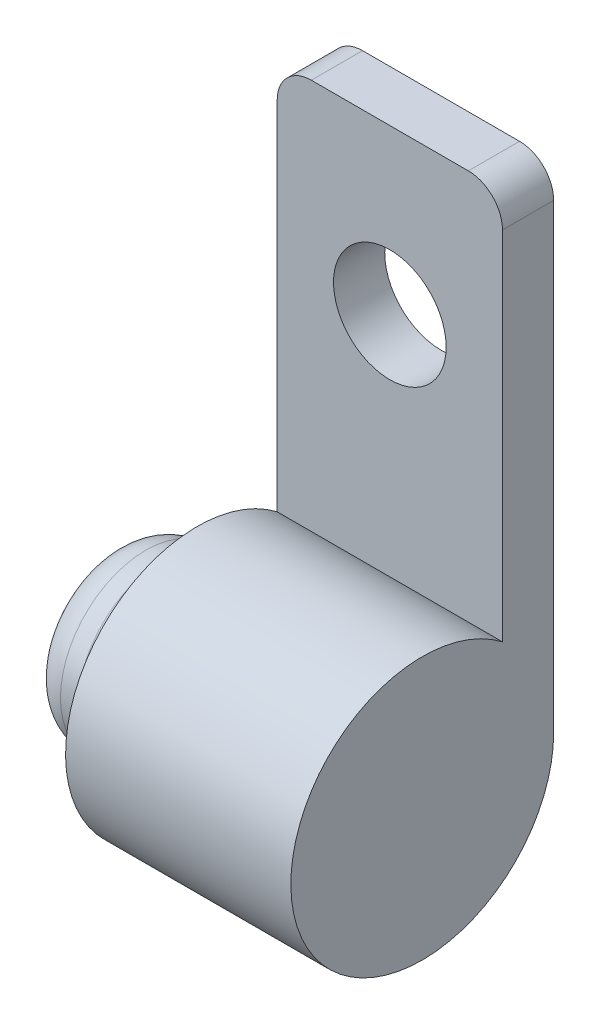
from build123d import *

# Parameters (mm, degrees)
SKETCH_1_R          = 3.85
EXTRUDE_1_DEPTH     = 6.6
EXTRUDE_2_DEPTH     = 6.6
SKETCH_3_R          = 1.65
CUT_EXTRUDE_1_DEPTH = 1.5
SKETCH_4_R          = 2.5
EXTRUDE_3_DEPTH     = 2.5
FILLET_1_R          = 1
FILLET_2_R          = 1


with BuildPart() as part:
    # 草图1 → 凸台-拉伸1 (new body)
    with BuildSketch(Plane(origin=(0, 0, 0), x_dir=(0, 0, -1), z_dir=(1, 0, 0))):
        Circle(SKETCH_1_R)
    extrude(amount=EXTRUDE_1_DEPTH)

    # 草图2 → 凸台-拉伸2 (add)
    with BuildSketch(Plane.ZY):
        with BuildLine():
            Line((-3.85, 0), (-3.85, 14.5))
            Line((-3.85, 14.5), (-2.35, 14.5))
            Line((-2.35, 14.5), (-2.35, 3.049590136))
            ThreePointArc((-2.35, 3.049590136), (-3.454706934, 1.699264547), (-3.85, 0))
        make_face()
    extrude(amount=-EXTRUDE_2_DEPTH)

    # 草图3 → 切除-拉伸1 (cut)
    with BuildSketch(Plane.XY.offset(-2.35)):
        with Locations((3.3, 9.7)):
            Circle(SKETCH_3_R)
    extrude(amount=-CUT_EXTRUDE_1_DEPTH, mode=Mode.SUBTRACT)

    # 草图4 → 凸台-拉伸3 (add)
    with BuildSketch(Plane.ZY):
        with Locations(Location((0, 0, 0), (0, 0, 180))):
            Circle(SKETCH_4_R)
    extrude(amount=EXTRUDE_3_DEPTH)

    # 圆角1
    fillet_1_edges = [part.edges().sort_by_distance(p)[0] for p in [
        (0, 0, 2.5),
        (-2.5, 0, 2.5),
    ]]
    fillet(fillet_1_edges, radius=FILLET_1_R)

    # 圆角2
    fillet_2_edges = [part.edges().sort_by_distance(p)[0] for p in [
        (0, 14.5, -3.1),
        (6.6, 14.5, -3.1),
    ]]
    fillet(fillet_2_edges, radius=FILLET_2_R)


solid = part.part
